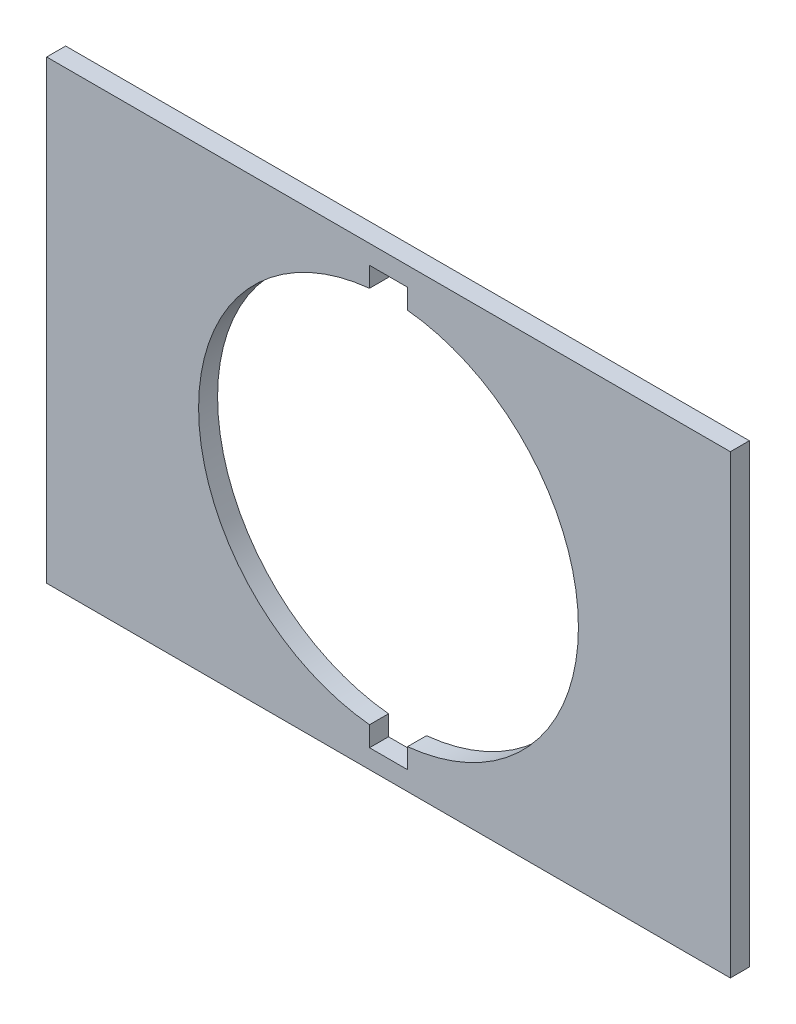
from build123d import *

# Parameters (mm, degrees)
SKETCH1_W           = 457.2
SKETCH1_H           = 304.8
SKETCH1_R           = 127
BOSS_EXTRUDE1_DEPTH = 12.7
CUT_EXTRUDE2_DEPTH  = 276.036379412


with BuildPart() as part:
    # Sketch1 → Boss-Extrude1 (new body)
    with BuildSketch(Plane.XY):
        Rectangle(SKETCH1_W, SKETCH1_H)
        Circle(SKETCH1_R, mode=Mode.SUBTRACT)
    extrude(amount=BOSS_EXTRUDE1_DEPTH)

    # Sketch2 → Cut-Extrude2 (cut, through all)
    with BuildSketch(Plane.XY.offset(12.7)):
        with BuildLine():
            ThreePointArc((-12.7, 126.363404513), (0, 127), (12.7, 126.363404513))
            Line((12.7, 126.363404513), (12.7, 139.7))
            Line((12.7, 139.7), (-12.7, 139.7))
            Line((-12.7, 139.7), (-12.7, 126.363404513))
        make_face()
    cut_extrude2 = extrude(amount=-CUT_EXTRUDE2_DEPTH, mode=Mode.SUBTRACT)

    # Mirror1: Cut-Extrude2 across plane
    add(cut_extrude2.mirror(Plane.ZX), mode=Mode.SUBTRACT)


solid = part.part
